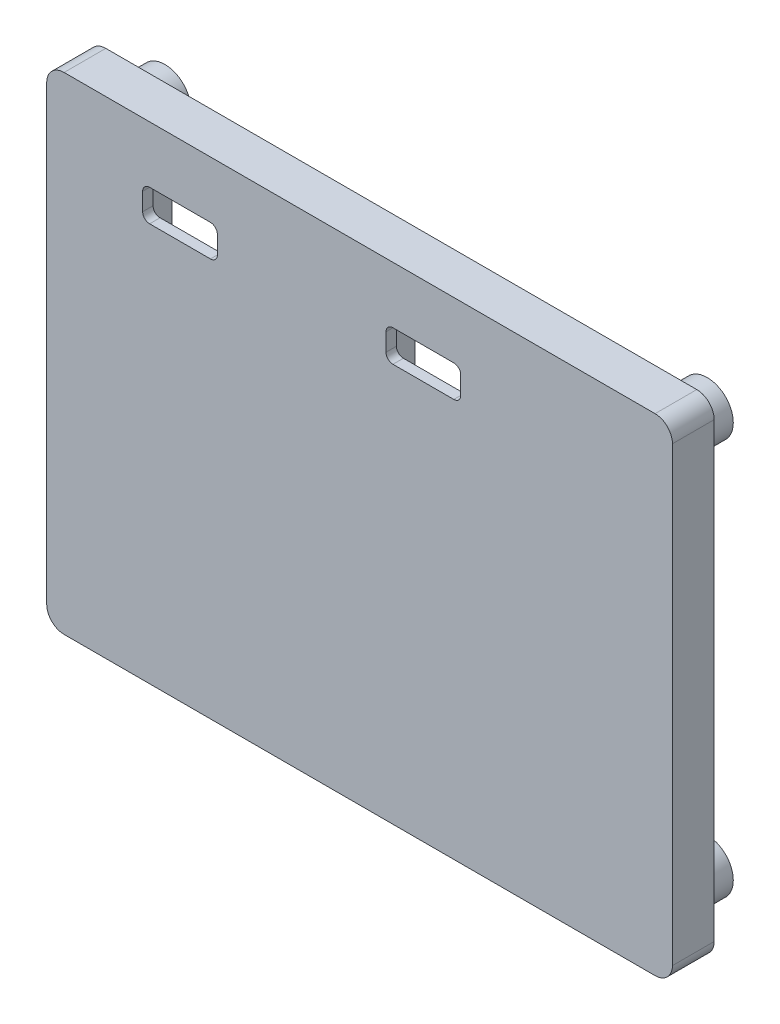
from build123d import *

# Parameters (mm, degrees)
SKETCH1_W           = 180
SKETCH1_H           = 140
BOSS_EXTRUDE1_DEPTH = 12
SKETCH2_W           = 62
SKETCH2_H           = 112
CUT_EXTRUDE1_DEPTH  = 9
SKETCH3_R           = 7.5
BOSS_EXTRUDE2_DEPTH = 10
SKETCH4_W           = 21.5
SKETCH4_H           = 9.1
CUT_EXTRUDE2_DEPTH  = 229.825260843
FILLET4_R           = 2
FILLET5_R           = 2
FILLET6_R           = 2
FILLET7_R           = 5


with BuildPart() as part:
    # Sketch1 → Boss-Extrude1 (new body)
    with BuildSketch(Plane.XY):
        with Locations((90, -70)):
            Rectangle(SKETCH1_W, SKETCH1_H)
    extrude(amount=BOSS_EXTRUDE1_DEPTH)

    # Sketch2 → Cut-Extrude1 (cut)
    with BuildSketch(Plane(origin=(0, 0, 0), x_dir=(-1, 0, 0), z_dir=(0, 0, -1))):
        with Locations((-125, -70)):
            Rectangle(SKETCH2_W, SKETCH2_H)
        with Locations((-55, -70)):
            Rectangle(SKETCH2_W, SKETCH2_H)
    extrude(amount=-CUT_EXTRUDE1_DEPTH, mode=Mode.SUBTRACT)

    # Sketch3 → Boss-Extrude2 (add)
    with BuildSketch(Plane(origin=(0, 0, 0), x_dir=(-1, 0, 0), z_dir=(0, 0, -1))):
        with Locations(Location((-168, -13, 0), (0, 0, 180))):
            Circle(SKETCH3_R)
        with Locations(Location((-12, -13, 0), (0, 0, 180))):
            Circle(SKETCH3_R)
        with Locations(Location((-12, -127, 0), (0, 0, 180))):
            Circle(SKETCH3_R)
        with Locations(Location((-168, -127, 0), (0, 0, 180))):
            Circle(SKETCH3_R)
    extrude(amount=BOSS_EXTRUDE2_DEPTH)

    # Sketch4 → Cut-Extrude2 (cut, through all)
    with BuildSketch(Plane(origin=(0, 0, 9), x_dir=(-1, 0, 0), z_dir=(0, 0, -1))):
        with Locations((-108.35, -20.85)):
            Rectangle(SKETCH4_W, SKETCH4_H)
        with Locations((-38.35, -20.85)):
            Rectangle(SKETCH4_W, SKETCH4_H)
    extrude(amount=-CUT_EXTRUDE2_DEPTH, mode=Mode.SUBTRACT)

    # Fillet4
    fillet4_edges = [part.edges().sort_by_distance(p)[0] for p in [
        (119.1, -16.3, 10.5),
    ]]
    fillet(fillet4_edges, radius=FILLET4_R)

    # Fillet5
    fillet5_edges = [part.edges().sort_by_distance(p)[0] for p in [
        (119.1, -25.4, 10.5),
        (97.6, -16.3, 10.5),
        (97.6, -25.4, 10.5),
    ]]
    fillet(fillet5_edges, radius=FILLET5_R)

    # Fillet6
    fillet6_edges = [part.edges().sort_by_distance(p)[0] for p in [
        (49.1, -25.4, 10.5),
        (49.1, -16.3, 10.5),
        (27.6, -16.3, 10.5),
        (27.6, -25.4, 10.5),
    ]]
    fillet(fillet6_edges, radius=FILLET6_R)

    # Fillet7
    fillet7_edges = [part.edges().sort_by_distance(p)[0] for p in [
        (0, 0, 6),
        (180, 0, 6),
        (180, -140, 6),
        (0, -140, 6),
    ]]
    fillet(fillet7_edges, radius=FILLET7_R)


solid = part.part
